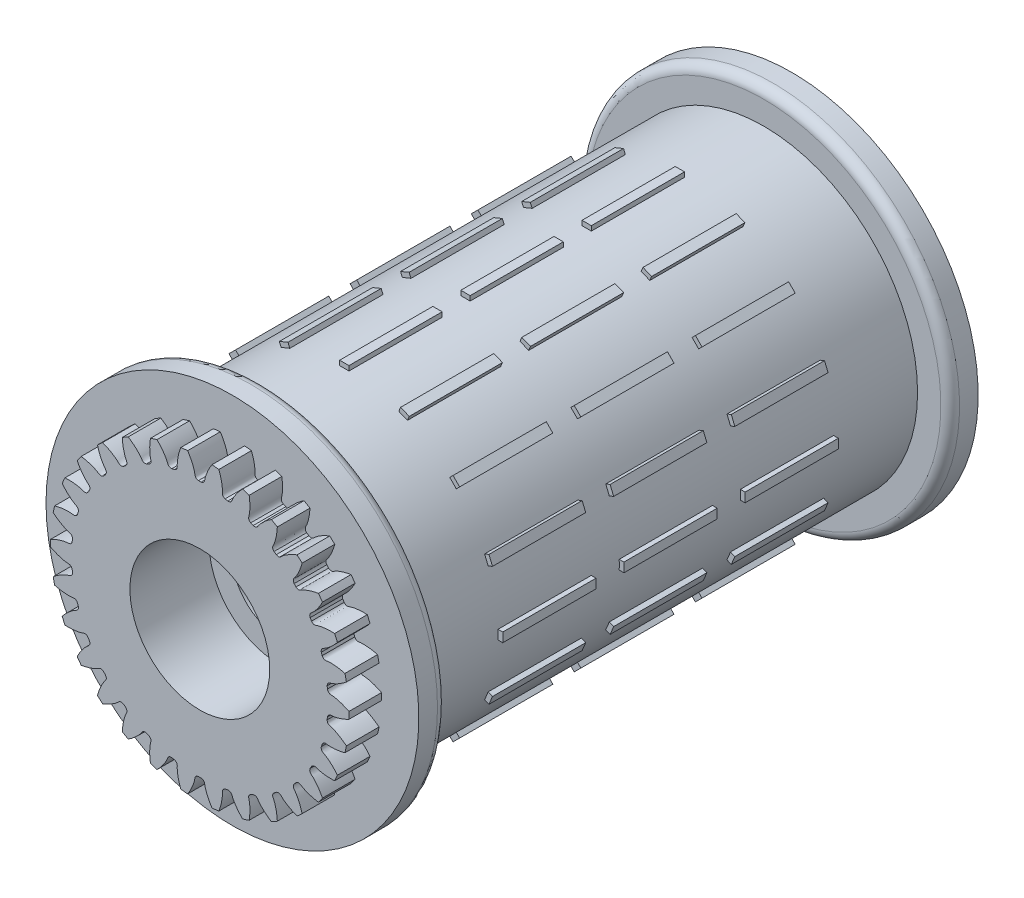
from build123d import *

# Parameters (mm, degrees)
FILLET_2_R                        = 1
EXTRUDE_START                     = 3.5
SKETCH_2_R                        = 7.5
EXTRUDE_1_DEPTH                   = 3.5
EXTRUDE_START_2                   = 15
SKETCH_4_W                        = 1
SKETCH_4_H                        = 10
EXTRUDE_2_DEPTH                   = 2
PATTERN_CIRCULAR_1_COUNT          = 16
PATTERN_LINEAR_1_COUNT            = 2
PATTERN_LINEAR_1_PITCH            = 13
PATTERN_START                     = 15
PATTERN_LINEAR_1_COPY_1_SKETCH_W  = 1
PATTERN_LINEAR_1_COPY_1_SKETCH_H  = 10
PATTERN_LINEAR_1_COPY_1_DEPTH     = 2
PATTERN_LINEAR_1_COPY_2_SKETCH_W  = 1
PATTERN_LINEAR_1_COPY_2_SKETCH_H  = 10
PATTERN_LINEAR_1_COPY_2_DEPTH     = 2
PATTERN_LINEAR_1_COPY_3_SKETCH_W  = 1
PATTERN_LINEAR_1_COPY_3_SKETCH_H  = 10
PATTERN_LINEAR_1_COPY_3_DEPTH     = 2
PATTERN_LINEAR_1_COPY_4_SKETCH_W  = 1
PATTERN_LINEAR_1_COPY_4_SKETCH_H  = 10
PATTERN_LINEAR_1_COPY_4_DEPTH     = 2
PATTERN_LINEAR_1_COPY_5_SKETCH_W  = 1
PATTERN_LINEAR_1_COPY_5_SKETCH_H  = 10
PATTERN_LINEAR_1_COPY_5_DEPTH     = 2
PATTERN_LINEAR_1_COPY_6_SKETCH_W  = 1
PATTERN_LINEAR_1_COPY_6_SKETCH_H  = 10
PATTERN_LINEAR_1_COPY_6_DEPTH     = 2
PATTERN_LINEAR_1_COPY_7_SKETCH_W  = 1
PATTERN_LINEAR_1_COPY_7_SKETCH_H  = 10
PATTERN_LINEAR_1_COPY_7_DEPTH     = 2
PATTERN_LINEAR_1_COPY_8_SKETCH_W  = 1
PATTERN_LINEAR_1_COPY_8_SKETCH_H  = 10
PATTERN_LINEAR_1_COPY_8_DEPTH     = 2
PATTERN_LINEAR_1_COPY_9_SKETCH_W  = 1
PATTERN_LINEAR_1_COPY_9_SKETCH_H  = 10
PATTERN_LINEAR_1_COPY_9_DEPTH     = 2
PATTERN_LINEAR_1_COPY_10_SKETCH_W = 1
PATTERN_LINEAR_1_COPY_10_SKETCH_H = 10
PATTERN_LINEAR_1_COPY_10_DEPTH    = 2
PATTERN_LINEAR_1_COPY_11_SKETCH_W = 1
PATTERN_LINEAR_1_COPY_11_SKETCH_H = 10
PATTERN_LINEAR_1_COPY_11_DEPTH    = 2
PATTERN_LINEAR_1_COPY_12_SKETCH_W = 1
PATTERN_LINEAR_1_COPY_12_SKETCH_H = 10
PATTERN_LINEAR_1_COPY_12_DEPTH    = 2
PATTERN_LINEAR_1_COPY_13_SKETCH_W = 1
PATTERN_LINEAR_1_COPY_13_SKETCH_H = 10
PATTERN_LINEAR_1_COPY_13_DEPTH    = 2
PATTERN_LINEAR_1_COPY_14_SKETCH_W = 1
PATTERN_LINEAR_1_COPY_14_SKETCH_H = 10
PATTERN_LINEAR_1_COPY_14_DEPTH    = 2
PATTERN_LINEAR_1_COPY_15_SKETCH_W = 1
PATTERN_LINEAR_1_COPY_15_SKETCH_H = 10
PATTERN_LINEAR_1_COPY_15_DEPTH    = 2
PATTERN_LINEAR_2_COUNT            = 2
PATTERN_LINEAR_2_PITCH            = 13
PATTERN_LINEAR_2_COPY_1_SKETCH_W  = 1
PATTERN_LINEAR_2_COPY_1_SKETCH_H  = 10
PATTERN_LINEAR_2_COPY_1_DEPTH     = 2
PATTERN_LINEAR_2_COPY_2_SKETCH_W  = 1
PATTERN_LINEAR_2_COPY_2_SKETCH_H  = 10
PATTERN_LINEAR_2_COPY_2_DEPTH     = 2
PATTERN_LINEAR_2_COPY_3_SKETCH_W  = 1
PATTERN_LINEAR_2_COPY_3_SKETCH_H  = 10
PATTERN_LINEAR_2_COPY_3_DEPTH     = 2
PATTERN_LINEAR_2_COPY_4_SKETCH_W  = 1
PATTERN_LINEAR_2_COPY_4_SKETCH_H  = 10
PATTERN_LINEAR_2_COPY_4_DEPTH     = 2
PATTERN_LINEAR_2_COPY_5_SKETCH_W  = 1
PATTERN_LINEAR_2_COPY_5_SKETCH_H  = 10
PATTERN_LINEAR_2_COPY_5_DEPTH     = 2
PATTERN_LINEAR_2_COPY_6_SKETCH_W  = 1
PATTERN_LINEAR_2_COPY_6_SKETCH_H  = 10
PATTERN_LINEAR_2_COPY_6_DEPTH     = 2
PATTERN_LINEAR_2_COPY_7_SKETCH_W  = 1
PATTERN_LINEAR_2_COPY_7_SKETCH_H  = 10
PATTERN_LINEAR_2_COPY_7_DEPTH     = 2
PATTERN_LINEAR_2_COPY_8_SKETCH_W  = 1
PATTERN_LINEAR_2_COPY_8_SKETCH_H  = 10
PATTERN_LINEAR_2_COPY_8_DEPTH     = 2
PATTERN_LINEAR_2_COPY_9_SKETCH_W  = 1
PATTERN_LINEAR_2_COPY_9_SKETCH_H  = 10
PATTERN_LINEAR_2_COPY_9_DEPTH     = 2
PATTERN_LINEAR_2_COPY_10_SKETCH_W = 1
PATTERN_LINEAR_2_COPY_10_SKETCH_H = 10
PATTERN_LINEAR_2_COPY_10_DEPTH    = 2
PATTERN_LINEAR_2_COPY_11_SKETCH_W = 1
PATTERN_LINEAR_2_COPY_11_SKETCH_H = 10
PATTERN_LINEAR_2_COPY_11_DEPTH    = 2
PATTERN_LINEAR_2_COPY_12_SKETCH_W = 1
PATTERN_LINEAR_2_COPY_12_SKETCH_H = 10
PATTERN_LINEAR_2_COPY_12_DEPTH    = 2
PATTERN_LINEAR_2_COPY_13_SKETCH_W = 1
PATTERN_LINEAR_2_COPY_13_SKETCH_H = 10
PATTERN_LINEAR_2_COPY_13_DEPTH    = 2
PATTERN_LINEAR_2_COPY_14_SKETCH_W = 1
PATTERN_LINEAR_2_COPY_14_SKETCH_H = 10
PATTERN_LINEAR_2_COPY_14_DEPTH    = 2
PATTERN_LINEAR_2_COPY_15_SKETCH_W = 1
PATTERN_LINEAR_2_COPY_15_SKETCH_H = 10
PATTERN_LINEAR_2_COPY_15_DEPTH    = 2


with BuildPart() as part:
    # 草图1 → 旋转1 (revolve)
    with BuildSketch(Plane(origin=(0, 0, 0), x_dir=(1, 0, 0), z_dir=(0, 1, 0)), mode=Mode.PRIVATE) as revolve_1_sk:
        Polygon((7.5, -55), (7.5, -60), (20, -60), (20, -57), (16.5, -57), (16.5, -3), (20, -3), (20, 0), (7.5, 0), (7.5, -5), (5, -5), (5, -55), align=None)
    revolve(revolve_1_sk.sketch.rotate(Axis((0, 0, 0), (0, 0, 1)), 180), axis=Axis((0, 0, 0), (0, 0, 1)))

    # 圆角2
    fillet_2_edges = [part.edges().sort_by_distance(p)[0] for p in [
        (20, 0, 3),
        (20, 0, 57),
    ]]
    fillet(fillet_2_edges, radius=FILLET_2_R)

    # 草图2 → 凸台-拉伸1 (add)
    with BuildSketch(Plane.XY.offset(60).offset(EXTRUDE_START)):
        with BuildLine():
            ThreePointArc((-2.716247736, 13.479039218), (-2.858785749, 13.44952951), (-3.001003383, 13.418512537))
            add(Edge.make_bspline(
                [(-3.001003383, 13.418512537), (-3.369003652, 13.40546142), (-3.419716461, 13.634070762), (-3.517532283, 13.860119802), (-3.538560643, 13.90630729), (-3.572718419, 13.977474487), (-3.624664976, 14.077588857), (-3.700110481, 14.209847265), (-3.792707643, 14.358131544), (-3.903840272, 14.521250385), (-4.034822464, 14.697928897), (-4.186895027, 14.886811473), (-4.361220932, 15.086465874), (-4.500096257, 15.233252262), (-4.580099062, 15.314041403), (-4.592702353, 15.326678867)],
                knots=[0.5485007, 0.5485007, 0.5485007, 0.5485007, 0.663824583, 0.67191327, 0.681013003, 0.691123781, 0.714378474, 0.741677349, 0.773020406, 0.808407645, 0.847839066, 0.891314668, 0.938834453, 0.990398419, 1, 1, 1, 1], degree=3))
            ThreePointArc((-4.592702353, 15.326678867), (-4.94427191, 15.216904261), (-5.293221551, 15.099066382))
            add(Edge.make_bspline(
                [(-5.293221551, 15.099066382), (-5.310855745, 14.986744462), (-5.337705864, 14.786448591), (-5.362979142, 14.504678569), (-5.374986111, 14.262483316), (-5.377103952, 14.042557981), (-5.371986269, 13.873454013), (-5.362807745, 13.723373087), (-5.353006616, 13.614785961), (-5.338258878, 13.493510224), (-5.325363451, 13.408005596), (-5.311166643, 13.330352687), (-5.30103062, 13.280626065), (-5.24729699, 13.040253852), (-5.153951314, 12.825496768), (-5.45934104, 12.619750212)],
                knots=[0, 0, 0, 0, 0.061165547, 0.108685332, 0.152160934, 0.191592355, 0.226979594, 0.243156645, 0.272477611, 0.285621526, 0.308876219, 0.318986997, 0.32808673, 0.336175417, 0.4514993, 0.4514993, 0.4514993, 0.4514993], degree=3))
            ThreePointArc((-5.45934104, 12.619750212), (-5.592628842, 12.561250043), (-5.725289888, 12.501342156))
            add(Edge.make_bspline(
                [(-5.725289888, 12.501342156), (-6.082534989, 12.412064679), (-6.179670156, 12.625134573), (-6.322346706, 12.825906846), (-6.352518465, 12.866712985), (-6.400726304, 12.929223207), (-6.472352651, 13.01634954), (-6.57364756, 13.130031783), (-6.695051288, 13.255823662), (-6.837669716, 13.392272193), (-7.002523161, 13.537857126), (-7.19054347, 13.6909945), (-7.402570419, 13.85004158), (-7.568929591, 13.96474653), (-7.66398115, 14.027136716), (-7.678936505, 14.036877649)],
                knots=[0.5485007, 0.5485007, 0.5485007, 0.5485007, 0.663824583, 0.67191327, 0.681013003, 0.691123781, 0.714378474, 0.741677349, 0.773020406, 0.808407645, 0.847839066, 0.891314668, 0.938834453, 0.990398419, 1, 1, 1, 1], degree=3))
            ThreePointArc((-7.678936505, 14.036877649), (-8, 13.856406461), (-8.316824382, 13.668592912))
            add(Edge.make_bspline(
                [(-8.316824382, 13.668592912), (-8.310720186, 13.555059141), (-8.295339712, 13.353557761), (-8.261477427, 13.072690481), (-8.22286679, 12.833291385), (-8.179213303, 12.617731623), (-8.139048762, 12.453387009), (-8.098867232, 12.308494033), (-8.066703747, 12.204317566), (-8.027063639, 12.088758222), (-7.996672596, 12.007803185), (-7.966641076, 11.934798861), (-7.946387802, 11.888266282), (-7.843852188, 11.664318629), (-7.70789583, 11.47366216), (-7.963834944, 11.208917565)],
                knots=[0, 0, 0, 0, 0.061165547, 0.108685332, 0.152160934, 0.191592355, 0.226979594, 0.243156645, 0.272477611, 0.285621526, 0.308876219, 0.318986997, 0.32808673, 0.336175417, 0.4514993, 0.4514993, 0.4514993, 0.4514993], degree=3))
            ThreePointArc((-7.963834944, 11.208917565), (-8.082047219, 11.123983673), (-8.199353753, 11.037803134))
            add(Edge.make_bspline(
                [(-8.199353753, 11.037803134), (-8.53023036, 10.876201151), (-8.669542613, 11.064419421), (-8.85084424, 11.231140215), (-8.888840747, 11.264781581), (-8.948991735, 11.315902831), (-9.037167458, 11.38623329), (-9.159884697, 11.476370907), (-9.304789065, 11.574172677), (-9.472660183, 11.677987442), (-9.664179994, 11.786116037), (-9.879930658, 11.896815372), (-10.120392058, 12.00830401), (-10.306964383, 12.085914364), (-10.412910486, 12.127178845), (-10.429564285, 12.133597522)],
                knots=[0.5485007, 0.5485007, 0.5485007, 0.5485007, 0.663824583, 0.67191327, 0.681013003, 0.691123781, 0.714378474, 0.741677349, 0.773020406, 0.808407645, 0.847839066, 0.891314668, 0.938834453, 0.990398419, 1, 1, 1, 1], degree=3))
            ThreePointArc((-10.429564285, 12.133597522), (-10.706089702, 11.890317208), (-10.976942078, 11.640736343))
            add(Edge.make_bspline(
                [(-10.976942078, 11.640736343), (-10.947366276, 11.530952691), (-10.890427409, 11.33705238), (-10.798909505, 11.069363088), (-10.711368733, 10.84322304), (-10.623851784, 10.641449846), (-10.550395768, 10.489047234), (-10.480967357, 10.355674727), (-10.427847216, 10.26046193), (-10.365047201, 10.155669477), (-10.318488777, 10.082802155), (-10.273935065, 10.017637055), (-10.244449707, 9.976332217), (-10.097593407, 9.77859671), (-9.924968313, 9.620373458), (-10.120271046, 9.308201435)],
                knots=[0, 0, 0, 0, 0.061165547, 0.108685332, 0.152160934, 0.191592355, 0.226979594, 0.243156645, 0.272477611, 0.285621526, 0.308876219, 0.318986997, 0.32808673, 0.336175417, 0.4514993, 0.4514993, 0.4514993, 0.4514993], degree=3))
            ThreePointArc((-10.120271046, 9.308201435), (-10.21824135, 9.200545837), (-10.315066514, 9.091859151))
            add(Edge.make_bspline(
                [(-10.315066514, 9.091859151), (-10.605113732, 8.864995444), (-10.780514456, 9.020136046), (-10.99251741, 9.145518864), (-11.036678035, 9.170525167), (-11.106143285, 9.208023201), (-11.207014682, 9.258484008), (-11.34579092, 9.321137553), (-11.50786291, 9.386674807), (-11.693649945, 9.453318602), (-11.903465788, 9.51926512), (-12.137517468, 9.582688324), (-12.395904, 9.641745931), (-12.594535372, 9.678869746), (-12.706745667, 9.697205065), (-12.724370058, 9.70002096)],
                knots=[0.5485007, 0.5485007, 0.5485007, 0.5485007, 0.663824583, 0.67191327, 0.681013003, 0.691123781, 0.714378474, 0.741677349, 0.773020406, 0.808407645, 0.847839066, 0.891314668, 0.938834453, 0.990398419, 1, 1, 1, 1], degree=3))
            ThreePointArc((-12.724370058, 9.70002096), (-12.94427191, 9.404564037), (-13.157314733, 9.104123738))
            add(Edge.make_bspline(
                [(-13.157314733, 9.104123738), (-13.105559928, 9.002888276), (-13.00955117, 8.825063409), (-12.864377419, 8.582251412), (-12.731732463, 8.379253817), (-12.604176964, 8.200085648), (-12.500639853, 8.066285763), (-12.404998916, 7.950262744), (-12.333243724, 7.868174873), (-12.250028464, 7.778729244), (-12.189337485, 7.717134288), (-12.132208792, 7.66265644), (-12.094780001, 7.628384562), (-11.91002134, 7.465503192), (-11.708272054, 7.346628273), (-11.834402742, 7.000672236)],
                knots=[0, 0, 0, 0, 0.061165547, 0.108685332, 0.152160934, 0.191592355, 0.226979594, 0.243156645, 0.272477611, 0.285621526, 0.308876219, 0.318986997, 0.32808673, 0.336175417, 0.4514993, 0.4514993, 0.4514993, 0.4514993], degree=3))
            ThreePointArc((-11.834402742, 7.000672236), (-11.907849302, 6.875), (-11.97996137, 6.748557295))
            add(Edge.make_bspline(
                [(-11.97996137, 6.748557295), (-12.216502744, 6.466346897), (-12.420326086, 6.581629444), (-12.653764821, 6.660194453), (-12.702159533, 6.675472798), (-12.777903081, 6.697708773), (-12.887061587, 6.726094547), (-13.035831635, 6.758525759), (-13.207987925, 6.788934206), (-13.403571092, 6.815494378), (-13.622513007, 6.836376639), (-13.864636522, 6.849751813), (-14.129655456, 6.85379729), (-14.331664731, 6.848812075), (-14.445235088, 6.843416892), (-14.463059802, 6.842506935)],
                knots=[0.5485007, 0.5485007, 0.5485007, 0.5485007, 0.663824583, 0.67191327, 0.681013003, 0.691123781, 0.714378474, 0.741677349, 0.773020406, 0.808407645, 0.847839066, 0.891314668, 0.938834453, 0.990398419, 1, 1, 1, 1], degree=3))
            ThreePointArc((-14.463059802, 6.842506935), (-14.616727322, 6.507786289), (-14.762649597, 6.169617238))
            add(Edge.make_bspline(
                [(-14.762649597, 6.169617238), (-14.690977723, 6.081354443), (-14.560095119, 5.927376819), (-14.367610309, 5.720054168), (-14.19565839, 5.549070993), (-14.033639128, 5.400338358), (-13.904545991, 5.290988898), (-13.786872496, 5.197386129), (-13.699618299, 5.132010818), (-13.5996247, 5.061821216), (-13.527453653, 5.014190622), (-13.460246778, 4.972780968), (-13.416510372, 4.947039897), (-13.20192419, 4.826131361), (-12.979868125, 4.75180018), (-13.031314249, 4.387180067)],
                knots=[0, 0, 0, 0, 0.061165547, 0.108685332, 0.152160934, 0.191592355, 0.226979594, 0.243156645, 0.272477611, 0.285621526, 0.308876219, 0.318986997, 0.32808673, 0.336175417, 0.4514993, 0.4514993, 0.4514993, 0.4514993], degree=3))
            ThreePointArc((-13.031314249, 4.387180067), (-13.077027099, 4.248983673), (-13.121274429, 4.110311102))
            add(Edge.make_bspline(
                [(-13.121274429, 4.110311102), (-13.293971965, 3.785087961), (-13.517309868, 3.855474052), (-13.76198199, 3.883787585), (-13.812495708, 3.888670236), (-13.891207196, 3.894672332), (-14.003882062, 3.899742479), (-14.156143956, 3.90053396), (-14.330860489, 3.894484604), (-14.527691864, 3.879800345), (-14.74619104, 3.854705695), (-14.985804431, 3.81744828), (-15.245873166, 3.766304818), (-15.44243157, 3.719428453), (-15.552398421, 3.690538562), (-15.569644431, 3.685942524)],
                knots=[0.5485007, 0.5485007, 0.5485007, 0.5485007, 0.663824583, 0.67191327, 0.681013003, 0.691123781, 0.714378474, 0.741677349, 0.773020406, 0.808407645, 0.847839066, 0.891314668, 0.938834453, 0.990398419, 1, 1, 1, 1], degree=3))
            ThreePointArc((-15.569644431, 3.685942524), (-15.650361612, 3.326587053), (-15.722785836, 2.96546886))
            add(Edge.make_bspline(
                [(-15.722785836, 2.96546886), (-15.634329297, 2.89403624), (-15.474293043, 2.77063542), (-15.242909686, 2.607863108), (-15.039165928, 2.47636714), (-14.849763922, 2.364570369), (-14.700756748, 2.284450429), (-14.566193592, 2.2173588), (-14.467253817, 2.171553265), (-14.354852079, 2.123687312), (-14.274355185, 2.092102765), (-14.20000739, 2.065571107), (-14.15187486, 2.04948585), (-13.916839603, 1.975834432), (-13.684181674, 1.949295616), (-13.658694793, 1.581947077)],
                knots=[0, 0, 0, 0, 0.061165547, 0.108685332, 0.152160934, 0.191592355, 0.226979594, 0.243156645, 0.272477611, 0.285621526, 0.308876219, 0.318986997, 0.32808673, 0.336175417, 0.4514993, 0.4514993, 0.4514993, 0.4514993], degree=3))
            ThreePointArc((-13.658694793, 1.581947077), (-13.674676061, 1.43726637), (-13.689124832, 1.29242459))
            add(Edge.make_bspline(
                [(-13.689124832, 1.29242459), (-13.79043082, 0.938402519), (-14.023522345, 0.960815944), (-14.268734509, 0.937640564), (-14.319159541, 0.931914124), (-14.3973989, 0.921420021), (-14.508665692, 0.902952952), (-14.657764856, 0.872070109), (-14.827405683, 0.829827336), (-15.016882791, 0.77454042), (-15.225389765, 0.704565615), (-15.452020775, 0.618303938), (-15.695773062, 0.514206754), (-15.878290048, 0.427487959), (-15.979847313, 0.376365988), (-15.995760887, 0.368284737)],
                knots=[0.5485007, 0.5485007, 0.5485007, 0.5485007, 0.663824583, 0.67191327, 0.681013003, 0.691123781, 0.714378474, 0.741677349, 0.773020406, 0.808407645, 0.847839066, 0.891314668, 0.938834453, 0.990398419, 1, 1, 1, 1], degree=3))
            ThreePointArc((-15.995760887, 0.368284737), (-16, 0), (-15.995760887, -0.368284737))
            add(Edge.make_bspline(
                [(-15.995760887, -0.368284737), (-15.894385659, -0.419765235), (-15.712190108, -0.507196043), (-15.452020766, -0.618304084), (-15.225389749, -0.70456584), (-15.016882775, -0.774540692), (-14.854473894, -0.821929486), (-14.708902131, -0.859577748), (-14.602600921, -0.883811587), (-14.48270354, -0.907261918), (-14.3973989, -0.921420021), (-14.319159541, -0.931914124), (-14.268734509, -0.937640564), (-14.023522345, -0.960815944), (-13.79043082, -0.938402519), (-13.689124832, -1.29242459)],
                knots=[0, 0, 0, 0, 0.061165547, 0.108685332, 0.152160934, 0.191592355, 0.226979594, 0.243156645, 0.272477611, 0.285621526, 0.308876219, 0.318986997, 0.32808673, 0.336175417, 0.4514993, 0.4514993, 0.4514993, 0.4514993], degree=3))
            ThreePointArc((-13.689124832, -1.29242459), (-13.674676061, -1.43726637), (-13.658694793, -1.581947077))
            add(Edge.make_bspline(
                [(-13.658694793, -1.581947077), (-13.684181674, -1.949295616), (-13.916839603, -1.975834432), (-14.15187486, -2.04948585), (-14.20000739, -2.065571107), (-14.274355185, -2.092102765), (-14.379351012, -2.133299952), (-14.518771097, -2.19450739), (-14.675922098, -2.271097368), (-14.849763881, -2.364570639), (-15.039165897, -2.476367364), (-15.242909665, -2.607863252), (-15.459692357, -2.760364613), (-15.620191058, -2.883135809), (-15.708900199, -2.954255586), (-15.722785836, -2.96546886)],
                knots=[0.5485007, 0.5485007, 0.5485007, 0.5485007, 0.663824583, 0.67191327, 0.681013003, 0.691123781, 0.714378474, 0.741677349, 0.773020406, 0.808407645, 0.847839066, 0.891314668, 0.938834453, 0.990398419, 1, 1, 1, 1], degree=3))
            ThreePointArc((-15.722785836, -2.96546886), (-15.650361612, -3.326587053), (-15.569644431, -3.685942524))
            add(Edge.make_bspline(
                [(-15.569644431, -3.685942524), (-15.459781098, -3.715220954), (-15.26338907, -3.762860604), (-14.985804391, -3.81744842), (-14.746190978, -3.854705912), (-14.527691792, -3.879800608), (-14.35897925, -3.892387138), (-14.208761066, -3.898946624), (-14.099744294, -3.900549631), (-13.97759136, -3.898559449), (-13.891207196, -3.894672332), (-13.812495708, -3.888670235), (-13.76198199, -3.883787585), (-13.517309868, -3.855474052), (-13.293971965, -3.785087961), (-13.121274429, -4.110311102)],
                knots=[0, 0, 0, 0, 0.061165547, 0.108685332, 0.152160934, 0.191592355, 0.226979594, 0.243156645, 0.272477611, 0.285621526, 0.308876219, 0.318986997, 0.32808673, 0.336175417, 0.4514993, 0.4514993, 0.4514993, 0.4514993], degree=3))
            ThreePointArc((-13.121274429, -4.110311102), (-13.077027099, -4.248983673), (-13.031314249, -4.387180067))
            add(Edge.make_bspline(
                [(-13.031314249, -4.387180067), (-12.979868125, -4.751800179), (-13.20192419, -4.826131361), (-13.416510372, -4.947039897), (-13.460246778, -4.972780968), (-13.527453653, -5.014190622), (-13.621589692, -5.076317411), (-13.745237372, -5.165174386), (-13.883030295, -5.27276422), (-14.033639032, -5.400338614), (-14.195658313, -5.549071205), (-14.367610259, -5.720054304), (-14.547948914, -5.914294801), (-14.679414766, -6.067752708), (-14.751398766, -6.155762014), (-14.762649597, -6.169617238)],
                knots=[0.5485007, 0.5485007, 0.5485007, 0.5485007, 0.663824583, 0.67191327, 0.681013003, 0.691123781, 0.714378474, 0.741677349, 0.773020406, 0.808407645, 0.847839066, 0.891314668, 0.938834453, 0.990398419, 1, 1, 1, 1], degree=3))
            ThreePointArc((-14.762649597, -6.169617238), (-14.616727322, -6.507786289), (-14.463059802, -6.842506935))
            add(Edge.make_bspline(
                [(-14.463059802, -6.842506935), (-14.349509918, -6.84830369), (-14.147504687, -6.854070101), (-13.864636454, -6.849751942), (-13.622512901, -6.836376839), (-13.403570966, -6.81549462), (-13.235928311, -6.792728795), (-13.087628961, -6.767912823), (-12.980661184, -6.746814939), (-12.861591366, -6.719471225), (-12.777903081, -6.697708773), (-12.702159533, -6.675472798), (-12.653764821, -6.660194453), (-12.420326086, -6.581629444), (-12.216502744, -6.466346897), (-11.97996137, -6.748557295)],
                knots=[0, 0, 0, 0, 0.061165547, 0.108685332, 0.152160934, 0.191592355, 0.226979594, 0.243156645, 0.272477611, 0.285621526, 0.308876219, 0.318986997, 0.32808673, 0.336175417, 0.4514993, 0.4514993, 0.4514993, 0.4514993], degree=3))
            ThreePointArc((-11.97996137, -6.748557295), (-11.907849302, -6.875), (-11.834402742, -7.000672236))
            add(Edge.make_bspline(
                [(-11.834402742, -7.000672236), (-11.708272054, -7.346628273), (-11.91002134, -7.465503192), (-12.094780001, -7.628384562), (-12.132208792, -7.66265644), (-12.189337485, -7.717134288), (-12.268499539, -7.797475441), (-12.370970817, -7.910098476), (-12.48338345, -8.043985973), (-12.604176817, -8.200085878), (-12.731732343, -8.379254008), (-12.864377341, -8.582251536), (-13.000390293, -8.809741927), (-13.097077608, -8.987179698), (-13.149190421, -9.088232104), (-13.157314733, -9.104123738)],
                knots=[0.5485007, 0.5485007, 0.5485007, 0.5485007, 0.663824583, 0.67191327, 0.681013003, 0.691123781, 0.714378474, 0.741677349, 0.773020406, 0.808407645, 0.847839066, 0.891314668, 0.938834453, 0.990398419, 1, 1, 1, 1], degree=3))
            ThreePointArc((-13.157314733, -9.104123738), (-12.94427191, -9.404564037), (-12.724370058, -9.70002096))
            add(Edge.make_bspline(
                [(-12.724370058, -9.70002096), (-12.612096299, -9.682082693), (-12.413306462, -9.645723845), (-12.137517375, -9.582688436), (-11.903465643, -9.519265293), (-11.693649772, -9.453318813), (-11.534403792, -9.396195608), (-11.394504669, -9.341088756), (-11.294260891, -9.29821206), (-11.183478112, -9.246709864), (-11.106143285, -9.208023201), (-11.036678035, -9.170525167), (-10.99251741, -9.145518864), (-10.780514456, -9.020136046), (-10.605113732, -8.864995444), (-10.315066514, -9.091859151)],
                knots=[0, 0, 0, 0, 0.061165547, 0.108685332, 0.152160934, 0.191592355, 0.226979594, 0.243156645, 0.272477611, 0.285621526, 0.308876219, 0.318986997, 0.32808673, 0.336175417, 0.4514993, 0.4514993, 0.4514993, 0.4514993], degree=3))
            ThreePointArc((-10.315066514, -9.091859151), (-10.21824135, -9.200545837), (-10.120271046, -9.308201435))
            add(Edge.make_bspline(
                [(-10.120271046, -9.308201435), (-9.924968313, -9.620373458), (-10.097593407, -9.77859671), (-10.244449707, -9.976332217), (-10.273935065, -10.017637055), (-10.318488777, -10.082802155), (-10.379217086, -10.177846377), (-10.456033475, -10.309313305), (-10.538152846, -10.46364694), (-10.623851593, -10.64145004), (-10.711368576, -10.843223202), (-10.798909403, -11.069363193), (-10.884652234, -11.320161056), (-10.942335313, -11.513823809), (-10.972299359, -11.623502841), (-10.976942078, -11.640736343)],
                knots=[0.5485007, 0.5485007, 0.5485007, 0.5485007, 0.663824583, 0.67191327, 0.681013003, 0.691123781, 0.714378474, 0.741677349, 0.773020406, 0.808407645, 0.847839066, 0.891314668, 0.938834453, 0.990398419, 1, 1, 1, 1], degree=3))
            ThreePointArc((-10.976942078, -11.640736343), (-10.706089702, -11.890317208), (-10.429564285, -12.133597522))
            add(Edge.make_bspline(
                [(-10.429564285, -12.133597522), (-10.323473552, -12.092708223), (-10.13658718, -12.015813171), (-9.879930544, -11.896815462), (-9.664179817, -11.786116175), (-9.47265997, -11.677987612), (-9.328770479, -11.589003585), (-9.203385846, -11.506014287), (-9.114247202, -11.443232696), (-9.016593201, -11.369822912), (-8.948991735, -11.315902831), (-8.888840747, -11.264781581), (-8.85084424, -11.231140215), (-8.669542613, -11.06441942), (-8.53023036, -10.876201151), (-8.199353753, -11.037803134)],
                knots=[0, 0, 0, 0, 0.061165547, 0.108685332, 0.152160934, 0.191592355, 0.226979594, 0.243156645, 0.272477611, 0.285621526, 0.308876219, 0.318986997, 0.32808673, 0.336175417, 0.4514993, 0.4514993, 0.4514993, 0.4514993], degree=3))
            ThreePointArc((-8.199353753, -11.037803134), (-8.082047219, -11.123983673), (-7.963834944, -11.208917565))
            add(Edge.make_bspline(
                [(-7.963834944, -11.208917565), (-7.70789583, -11.47366216), (-7.843852188, -11.664318629), (-7.946387802, -11.888266282), (-7.966641076, -11.934798861), (-7.996672596, -12.007803185), (-8.036313041, -12.113396588), (-8.084117296, -12.257961674), (-8.132354395, -12.425996326), (-8.179213075, -12.617731773), (-8.222866603, -12.833291511), (-8.261477306, -13.072690562), (-8.293202642, -13.335834827), (-8.309360456, -13.53725857), (-8.315866164, -13.650770728), (-8.316824382, -13.668592912)],
                knots=[0.5485007, 0.5485007, 0.5485007, 0.5485007, 0.663824583, 0.67191327, 0.681013003, 0.691123781, 0.714378474, 0.741677349, 0.773020406, 0.808407645, 0.847839066, 0.891314668, 0.938834453, 0.990398419, 1, 1, 1, 1], degree=3))
            ThreePointArc((-8.316824382, -13.668592912), (-8, -13.856406461), (-7.678936505, -14.036877649))
            add(Edge.make_bspline(
                [(-7.678936505, -14.036877649), (-7.583665473, -13.974824375), (-7.416850396, -13.860753804), (-7.190543339, -13.690994565), (-7.002522959, -13.537857225), (-6.837669472, -13.392272315), (-6.715425132, -13.275316495), (-6.610034899, -13.168071781), (-6.535897174, -13.088129153), (-6.455639901, -12.99602014), (-6.400726304, -12.929223207), (-6.352518465, -12.866712985), (-6.322346706, -12.825906846), (-6.179670156, -12.625134573), (-6.082534989, -12.412064679), (-5.725289888, -12.501342156)],
                knots=[0, 0, 0, 0, 0.061165547, 0.108685332, 0.152160934, 0.191592355, 0.226979594, 0.243156645, 0.272477611, 0.285621526, 0.308876219, 0.318986997, 0.32808673, 0.336175417, 0.4514993, 0.4514993, 0.4514993, 0.4514993], degree=3))
            ThreePointArc((-5.725289888, -12.501342156), (-5.592628842, -12.561250043), (-5.45934104, -12.619750212))
            add(Edge.make_bspline(
                [(-5.45934104, -12.619750212), (-5.153951314, -12.825496768), (-5.24729699, -13.040253852), (-5.30103062, -13.280626065), (-5.311166643, -13.330352687), (-5.325363451, -13.408005596), (-5.342183553, -13.519533242), (-5.3588864, -13.670878297), (-5.371133034, -13.845270045), (-5.377103698, -14.04255808), (-5.374985902, -14.2624834), (-5.362979007, -14.504678624), (-5.3393003, -14.768668623), (-5.313226676, -14.969050173), (-5.295989713, -15.08143443), (-5.293221551, -15.099066382)],
                knots=[0.5485007, 0.5485007, 0.5485007, 0.5485007, 0.663824583, 0.67191327, 0.681013003, 0.691123781, 0.714378474, 0.741677349, 0.773020406, 0.808407645, 0.847839066, 0.891314668, 0.938834453, 0.990398419, 1, 1, 1, 1], degree=3))
            ThreePointArc((-5.293221551, -15.099066382), (-4.94427191, -15.216904261), (-4.592702353, -15.326678867))
            add(Edge.make_bspline(
                [(-4.592702353, -15.326678867), (-4.512414822, -15.246173645), (-4.372961661, -15.099912984), (-4.186894886, -14.886811509), (-4.034822245, -14.697928952), (-3.903840008, -14.521250455), (-3.808583482, -14.381434372), (-3.727793709, -14.254621351), (-3.671897078, -14.161011561), (-3.612544159, -14.054228926), (-3.572718419, -13.977474487), (-3.538560643, -13.90630729), (-3.517532283, -13.860119802), (-3.419716461, -13.634070762), (-3.369003652, -13.40546142), (-3.001003383, -13.418512537)],
                knots=[0, 0, 0, 0, 0.061165547, 0.108685332, 0.152160934, 0.191592355, 0.226979594, 0.243156645, 0.272477611, 0.285621526, 0.308876219, 0.318986997, 0.32808673, 0.336175417, 0.4514993, 0.4514993, 0.4514993, 0.4514993], degree=3))
            ThreePointArc((-3.001003383, -13.418512537), (-2.858785749, -13.44952951), (-2.716247736, -13.479039218))
            add(Edge.make_bspline(
                [(-2.716247736, -13.479039218), (-2.374754393, -13.616795624), (-2.421409734, -13.846267408), (-2.423992962, -14.092558761), (-2.423568743, -14.143306135), (-2.421310368, -14.222213824), (-2.41457501, -14.334801419), (-2.399446453, -14.486311939), (-2.375167385, -14.659439027), (-2.339989088, -14.853657216), (-2.292192525, -15.068336326), (-2.230092791, -15.302742628), (-2.152044913, -15.556040733), (-2.084879394, -15.746622454), (-2.044653099, -15.852967079), (-2.038279539, -15.869638198)],
                knots=[0.5485007, 0.5485007, 0.5485007, 0.5485007, 0.663824583, 0.67191327, 0.681013003, 0.691123781, 0.714378474, 0.741677349, 0.773020406, 0.808407645, 0.847839066, 0.891314668, 0.938834453, 0.990398419, 1, 1, 1, 1], degree=3))
            ThreePointArc((-2.038279539, -15.869638198), (-1.672455412, -15.912350326), (-1.30574507, -15.946630673))
            add(Edge.make_bspline(
                [(-1.30574507, -15.946630673), (-1.243949991, -15.851191966), (-1.137953517, -15.67913351), (-1.000259035, -15.432003355), (-0.890780439, -15.215630655), (-0.799394002, -15.015580268), (-0.735288458, -14.859014558), (-0.682630045, -14.718175567), (-0.64741746, -14.614989813), (-0.611562902, -14.498200468), (-0.588565596, -14.414843061), (-0.569950741, -14.338129238), (-0.55898482, -14.288579015), (-0.510304747, -14.047132636), (-0.50823069, -13.81297517), (-0.145558629, -13.749229531)],
                knots=[0, 0, 0, 0, 0.061165547, 0.108685332, 0.152160934, 0.191592355, 0.226979594, 0.243156645, 0.272477611, 0.285621526, 0.308876219, 0.318986997, 0.32808673, 0.336175417, 0.4514993, 0.4514993, 0.4514993, 0.4514993], degree=3))
            ThreePointArc((-0.145558629, -13.749229531), (0, -13.75), (0.145558629, -13.749229531))
            add(Edge.make_bspline(
                [(0.145558629, -13.749229531), (0.50823069, -13.81297517), (0.510304747, -14.047132636), (0.55898482, -14.288579015), (0.569950741, -14.338129238), (0.588565596, -14.414843061), (0.618562048, -14.523569988), (0.664860818, -14.668624235), (0.724604475, -14.832920179), (0.799394275, -15.015580256), (0.890780664, -15.215630647), (1.000259181, -15.432003349), (1.129265163, -15.663539216), (1.234587123, -15.835991773), (1.296044667, -15.931648996), (1.30574507, -15.946630673)],
                knots=[0.5485007, 0.5485007, 0.5485007, 0.5485007, 0.663824583, 0.67191327, 0.681013003, 0.691123781, 0.714378474, 0.741677349, 0.773020406, 0.808407645, 0.847839066, 0.891314668, 0.938834453, 0.990398419, 1, 1, 1, 1], degree=3))
            ThreePointArc((1.30574507, -15.946630673), (1.672455412, -15.912350326), (2.038279539, -15.869638198))
            add(Edge.make_bspline(
                [(2.038279539, -15.869638198), (2.078881424, -15.763437136), (2.146788656, -15.573100664), (2.230092935, -15.302742603), (2.292192747, -15.068336286), (2.339989357, -14.853657172), (2.370142199, -14.687184505), (2.392367827, -14.538474885), (2.405357408, -14.430222879), (2.416146588, -14.30853108), (2.421310368, -14.222213824), (2.423568743, -14.143306135), (2.423992962, -14.092558761), (2.421409734, -13.846267408), (2.374754393, -13.616795624), (2.716247735, -13.479039218)],
                knots=[0, 0, 0, 0, 0.061165547, 0.108685332, 0.152160934, 0.191592355, 0.226979594, 0.243156645, 0.272477611, 0.285621526, 0.308876219, 0.318986997, 0.32808673, 0.336175417, 0.4514993, 0.4514993, 0.4514993, 0.4514993], degree=3))
            ThreePointArc((2.716247735, -13.479039218), (2.858785749, -13.44952951), (3.001003383, -13.418512537))
            add(Edge.make_bspline(
                [(3.001003383, -13.418512537), (3.369003652, -13.40546142), (3.419716461, -13.634070762), (3.517532283, -13.860119802), (3.538560643, -13.90630729), (3.572718419, -13.977474487), (3.624664976, -14.077588857), (3.700110481, -14.209847265), (3.792707643, -14.358131544), (3.903840272, -14.521250385), (4.034822464, -14.697928897), (4.186895027, -14.886811473), (4.361220932, -15.086465874), (4.500096257, -15.233252262), (4.580099062, -15.314041403), (4.592702353, -15.326678867)],
                knots=[0.5485007, 0.5485007, 0.5485007, 0.5485007, 0.663824583, 0.67191327, 0.681013003, 0.691123781, 0.714378474, 0.741677349, 0.773020406, 0.808407645, 0.847839066, 0.891314668, 0.938834453, 0.990398419, 1, 1, 1, 1], degree=3))
            ThreePointArc((4.592702353, -15.326678867), (4.94427191, -15.216904261), (5.293221551, -15.099066382))
            add(Edge.make_bspline(
                [(5.293221551, -15.099066382), (5.310855745, -14.986744462), (5.337705864, -14.786448591), (5.362979142, -14.504678569), (5.374986111, -14.262483316), (5.377103952, -14.042557981), (5.371986269, -13.873454013), (5.362807745, -13.723373087), (5.353006616, -13.614785961), (5.338258878, -13.493510224), (5.325363451, -13.408005596), (5.311166643, -13.330352687), (5.30103062, -13.280626065), (5.24729699, -13.040253852), (5.153951314, -12.825496768), (5.45934104, -12.619750212)],
                knots=[0, 0, 0, 0, 0.061165547, 0.108685332, 0.152160934, 0.191592355, 0.226979594, 0.243156645, 0.272477611, 0.285621526, 0.308876219, 0.318986997, 0.32808673, 0.336175417, 0.4514993, 0.4514993, 0.4514993, 0.4514993], degree=3))
            ThreePointArc((5.45934104, -12.619750212), (5.592628842, -12.561250043), (5.725289888, -12.501342156))
            add(Edge.make_bspline(
                [(5.725289888, -12.501342156), (6.082534989, -12.412064679), (6.179670156, -12.625134573), (6.322346706, -12.825906846), (6.352518465, -12.866712985), (6.400726304, -12.929223207), (6.472352651, -13.01634954), (6.57364756, -13.130031783), (6.695051288, -13.255823662), (6.837669716, -13.392272193), (7.002523161, -13.537857126), (7.19054347, -13.6909945), (7.402570419, -13.85004158), (7.568929591, -13.96474653), (7.66398115, -14.027136716), (7.678936505, -14.036877649)],
                knots=[0.5485007, 0.5485007, 0.5485007, 0.5485007, 0.663824583, 0.67191327, 0.681013003, 0.691123781, 0.714378474, 0.741677349, 0.773020406, 0.808407645, 0.847839066, 0.891314668, 0.938834453, 0.990398419, 1, 1, 1, 1], degree=3))
            ThreePointArc((7.678936505, -14.036877649), (8, -13.856406461), (8.316824382, -13.668592912))
            add(Edge.make_bspline(
                [(8.316824382, -13.668592912), (8.310720186, -13.555059141), (8.295339712, -13.353557761), (8.261477427, -13.072690481), (8.22286679, -12.833291385), (8.179213303, -12.617731623), (8.139048762, -12.453387009), (8.098867232, -12.308494033), (8.066703747, -12.204317566), (8.027063639, -12.088758222), (7.996672596, -12.007803185), (7.966641076, -11.934798861), (7.946387802, -11.888266282), (7.843852188, -11.664318629), (7.70789583, -11.47366216), (7.963834944, -11.208917565)],
                knots=[0, 0, 0, 0, 0.061165547, 0.108685332, 0.152160934, 0.191592355, 0.226979594, 0.243156645, 0.272477611, 0.285621526, 0.308876219, 0.318986997, 0.32808673, 0.336175417, 0.4514993, 0.4514993, 0.4514993, 0.4514993], degree=3))
            ThreePointArc((7.963834944, -11.208917565), (8.082047219, -11.123983673), (8.199353753, -11.037803134))
            add(Edge.make_bspline(
                [(8.199353753, -11.037803134), (8.53023036, -10.876201151), (8.669542613, -11.06441942), (8.85084424, -11.231140215), (8.888840747, -11.264781581), (8.948991735, -11.315902831), (9.037167458, -11.38623329), (9.159884697, -11.476370907), (9.304789065, -11.574172677), (9.472660183, -11.677987442), (9.664179994, -11.786116037), (9.879930658, -11.896815372), (10.120392058, -12.00830401), (10.306964383, -12.085914364), (10.412910486, -12.127178845), (10.429564285, -12.133597522)],
                knots=[0.5485007, 0.5485007, 0.5485007, 0.5485007, 0.663824583, 0.67191327, 0.681013003, 0.691123781, 0.714378474, 0.741677349, 0.773020406, 0.808407645, 0.847839066, 0.891314668, 0.938834453, 0.990398419, 1, 1, 1, 1], degree=3))
            ThreePointArc((10.429564285, -12.133597522), (10.706089702, -11.890317208), (10.976942078, -11.640736343))
            add(Edge.make_bspline(
                [(10.976942078, -11.640736343), (10.947366276, -11.530952691), (10.890427409, -11.33705238), (10.798909505, -11.069363088), (10.711368733, -10.84322304), (10.623851784, -10.641449846), (10.550395768, -10.489047234), (10.480967357, -10.355674727), (10.427847216, -10.26046193), (10.365047201, -10.155669477), (10.318488777, -10.082802155), (10.273935065, -10.017637055), (10.244449707, -9.976332217), (10.097593407, -9.77859671), (9.924968313, -9.620373458), (10.120271046, -9.308201435)],
                knots=[0, 0, 0, 0, 0.061165547, 0.108685332, 0.152160934, 0.191592355, 0.226979594, 0.243156645, 0.272477611, 0.285621526, 0.308876219, 0.318986997, 0.32808673, 0.336175417, 0.4514993, 0.4514993, 0.4514993, 0.4514993], degree=3))
            ThreePointArc((10.120271046, -9.308201435), (10.21824135, -9.200545837), (10.315066514, -9.091859151))
            add(Edge.make_bspline(
                [(10.315066514, -9.091859151), (10.605113732, -8.864995444), (10.780514456, -9.020136046), (10.99251741, -9.145518864), (11.036678035, -9.170525167), (11.106143285, -9.208023201), (11.207014682, -9.258484008), (11.345790919, -9.321137553), (11.50786291, -9.386674807), (11.693649945, -9.453318602), (11.903465788, -9.51926512), (12.137517468, -9.582688324), (12.395904, -9.641745931), (12.594535372, -9.678869746), (12.706745667, -9.697205065), (12.724370058, -9.70002096)],
                knots=[0.5485007, 0.5485007, 0.5485007, 0.5485007, 0.663824583, 0.67191327, 0.681013003, 0.691123781, 0.714378474, 0.741677349, 0.773020406, 0.808407645, 0.847839066, 0.891314668, 0.938834453, 0.990398419, 1, 1, 1, 1], degree=3))
            ThreePointArc((12.724370058, -9.70002096), (12.94427191, -9.404564037), (13.157314733, -9.104123738))
            add(Edge.make_bspline(
                [(13.157314733, -9.104123738), (13.105559928, -9.002888276), (13.00955117, -8.825063409), (12.864377419, -8.582251412), (12.731732463, -8.379253817), (12.604176964, -8.200085648), (12.500639853, -8.066285763), (12.404998916, -7.950262744), (12.333243724, -7.868174873), (12.250028464, -7.778729244), (12.189337485, -7.717134288), (12.132208792, -7.66265644), (12.094780001, -7.628384562), (11.91002134, -7.465503192), (11.708272054, -7.346628273), (11.834402742, -7.000672236)],
                knots=[0, 0, 0, 0, 0.061165547, 0.108685332, 0.152160934, 0.191592355, 0.226979594, 0.243156645, 0.272477611, 0.285621526, 0.308876219, 0.318986997, 0.32808673, 0.336175417, 0.4514993, 0.4514993, 0.4514993, 0.4514993], degree=3))
            ThreePointArc((11.834402742, -7.000672236), (11.907849302, -6.875), (11.97996137, -6.748557295))
            add(Edge.make_bspline(
                [(11.97996137, -6.748557295), (12.216502744, -6.466346897), (12.420326086, -6.581629444), (12.653764821, -6.660194453), (12.702159533, -6.675472798), (12.777903081, -6.697708773), (12.887061587, -6.726094547), (13.035831635, -6.758525759), (13.207987925, -6.788934206), (13.403571092, -6.815494378), (13.622513007, -6.836376639), (13.864636522, -6.849751813), (14.129655456, -6.85379729), (14.331664731, -6.848812075), (14.445235088, -6.843416892), (14.463059802, -6.842506935)],
                knots=[0.5485007, 0.5485007, 0.5485007, 0.5485007, 0.663824583, 0.67191327, 0.681013003, 0.691123781, 0.714378474, 0.741677349, 0.773020406, 0.808407645, 0.847839066, 0.891314668, 0.938834453, 0.990398419, 1, 1, 1, 1], degree=3))
            ThreePointArc((14.463059802, -6.842506935), (14.616727322, -6.507786289), (14.762649597, -6.169617238))
            add(Edge.make_bspline(
                [(14.762649597, -6.169617238), (14.690977723, -6.081354443), (14.560095119, -5.927376819), (14.367610309, -5.720054167), (14.19565839, -5.549070993), (14.033639128, -5.400338358), (13.904545991, -5.290988898), (13.786872496, -5.197386129), (13.699618299, -5.132010818), (13.5996247, -5.061821216), (13.527453653, -5.014190622), (13.460246778, -4.972780968), (13.416510372, -4.947039897), (13.20192419, -4.826131361), (12.979868125, -4.751800179), (13.031314249, -4.387180067)],
                knots=[0, 0, 0, 0, 0.061165547, 0.108685332, 0.152160934, 0.191592355, 0.226979594, 0.243156645, 0.272477611, 0.285621526, 0.308876219, 0.318986997, 0.32808673, 0.336175417, 0.4514993, 0.4514993, 0.4514993, 0.4514993], degree=3))
            ThreePointArc((13.031314249, -4.387180067), (13.077027099, -4.248983673), (13.121274429, -4.110311102))
            add(Edge.make_bspline(
                [(13.121274429, -4.110311102), (13.293971965, -3.785087961), (13.517309868, -3.855474052), (13.76198199, -3.883787585), (13.812495708, -3.888670235), (13.891207196, -3.894672332), (14.003882062, -3.899742479), (14.156143956, -3.90053396), (14.330860489, -3.894484604), (14.527691864, -3.879800345), (14.74619104, -3.854705695), (14.985804431, -3.81744828), (15.245873166, -3.766304818), (15.44243157, -3.719428453), (15.552398421, -3.690538562), (15.569644431, -3.685942524)],
                knots=[0.5485007, 0.5485007, 0.5485007, 0.5485007, 0.663824583, 0.67191327, 0.681013003, 0.691123781, 0.714378474, 0.741677349, 0.773020406, 0.808407645, 0.847839066, 0.891314668, 0.938834453, 0.990398419, 1, 1, 1, 1], degree=3))
            ThreePointArc((15.569644431, -3.685942524), (15.650361612, -3.326587053), (15.722785836, -2.96546886))
            add(Edge.make_bspline(
                [(15.722785836, -2.96546886), (15.634329297, -2.89403624), (15.474293043, -2.77063542), (15.242909686, -2.607863108), (15.039165928, -2.47636714), (14.849763922, -2.364570369), (14.700756748, -2.284450429), (14.566193592, -2.2173588), (14.467253817, -2.171553265), (14.354852079, -2.123687312), (14.274355185, -2.092102765), (14.20000739, -2.065571107), (14.15187486, -2.04948585), (13.916839603, -1.975834432), (13.684181674, -1.949295616), (13.658694793, -1.581947077)],
                knots=[0, 0, 0, 0, 0.061165547, 0.108685332, 0.152160934, 0.191592355, 0.226979594, 0.243156645, 0.272477611, 0.285621526, 0.308876219, 0.318986997, 0.32808673, 0.336175417, 0.4514993, 0.4514993, 0.4514993, 0.4514993], degree=3))
            ThreePointArc((13.658694793, -1.581947077), (13.674676061, -1.43726637), (13.689124832, -1.29242459))
            add(Edge.make_bspline(
                [(13.689124832, -1.29242459), (13.79043082, -0.938402519), (14.023522345, -0.960815944), (14.268734509, -0.937640564), (14.319159541, -0.931914124), (14.3973989, -0.921420021), (14.508665692, -0.902952952), (14.657764856, -0.872070109), (14.827405683, -0.829827336), (15.016882791, -0.77454042), (15.225389765, -0.704565615), (15.452020775, -0.618303938), (15.695773062, -0.514206754), (15.878290048, -0.427487959), (15.979847313, -0.376365988), (15.995760887, -0.368284737)],
                knots=[0.5485007, 0.5485007, 0.5485007, 0.5485007, 0.663824583, 0.67191327, 0.681013003, 0.691123781, 0.714378474, 0.741677349, 0.773020406, 0.808407645, 0.847839066, 0.891314668, 0.938834453, 0.990398419, 1, 1, 1, 1], degree=3))
            ThreePointArc((15.995760887, -0.368284737), (16, 0), (15.995760887, 0.368284737))
            add(Edge.make_bspline(
                [(15.995760887, 0.368284737), (15.894385659, 0.419765235), (15.712190108, 0.507196043), (15.452020766, 0.618304084), (15.225389749, 0.70456584), (15.016882775, 0.774540692), (14.854473894, 0.821929486), (14.708902131, 0.859577748), (14.602600921, 0.883811587), (14.48270354, 0.907261918), (14.3973989, 0.921420021), (14.319159541, 0.931914124), (14.268734509, 0.937640564), (14.023522345, 0.960815944), (13.79043082, 0.938402519), (13.689124832, 1.29242459)],
                knots=[0, 0, 0, 0, 0.061165547, 0.108685332, 0.152160934, 0.191592355, 0.226979594, 0.243156645, 0.272477611, 0.285621526, 0.308876219, 0.318986997, 0.32808673, 0.336175417, 0.4514993, 0.4514993, 0.4514993, 0.4514993], degree=3))
            ThreePointArc((13.689124832, 1.29242459), (13.674676061, 1.43726637), (13.658694793, 1.581947077))
            add(Edge.make_bspline(
                [(13.658694793, 1.581947077), (13.684181674, 1.949295616), (13.916839603, 1.975834432), (14.15187486, 2.04948585), (14.20000739, 2.065571107), (14.274355185, 2.092102765), (14.379351012, 2.133299952), (14.518771097, 2.19450739), (14.675922098, 2.271097368), (14.849763881, 2.364570639), (15.039165897, 2.476367364), (15.242909665, 2.607863252), (15.459692357, 2.760364613), (15.620191058, 2.883135809), (15.708900199, 2.954255586), (15.722785836, 2.96546886)],
                knots=[0.5485007, 0.5485007, 0.5485007, 0.5485007, 0.663824583, 0.67191327, 0.681013003, 0.691123781, 0.714378474, 0.741677349, 0.773020406, 0.808407645, 0.847839066, 0.891314668, 0.938834453, 0.990398419, 1, 1, 1, 1], degree=3))
            ThreePointArc((15.722785836, 2.96546886), (15.650361612, 3.326587053), (15.569644431, 3.685942524))
            add(Edge.make_bspline(
                [(15.569644431, 3.685942524), (15.459781098, 3.715220954), (15.26338907, 3.762860604), (14.985804391, 3.81744842), (14.746190978, 3.854705912), (14.527691792, 3.879800608), (14.35897925, 3.892387138), (14.208761066, 3.898946624), (14.099744294, 3.900549631), (13.97759136, 3.898559449), (13.891207196, 3.894672332), (13.812495708, 3.888670236), (13.76198199, 3.883787585), (13.517309868, 3.855474052), (13.293971965, 3.785087961), (13.121274429, 4.110311102)],
                knots=[0, 0, 0, 0, 0.061165547, 0.108685332, 0.152160934, 0.191592355, 0.226979594, 0.243156645, 0.272477611, 0.285621526, 0.308876219, 0.318986997, 0.32808673, 0.336175417, 0.4514993, 0.4514993, 0.4514993, 0.4514993], degree=3))
            ThreePointArc((13.121274429, 4.110311102), (13.077027099, 4.248983673), (13.031314249, 4.387180067))
            add(Edge.make_bspline(
                [(13.031314249, 4.387180067), (12.979868125, 4.75180018), (13.20192419, 4.826131361), (13.416510372, 4.947039897), (13.460246778, 4.972780968), (13.527453653, 5.014190622), (13.621589692, 5.076317411), (13.745237372, 5.165174386), (13.883030295, 5.27276422), (14.033639032, 5.400338614), (14.195658313, 5.549071205), (14.367610259, 5.720054304), (14.547948913, 5.914294801), (14.679414766, 6.067752708), (14.751398766, 6.155762014), (14.762649597, 6.169617238)],
                knots=[0.5485007, 0.5485007, 0.5485007, 0.5485007, 0.663824583, 0.67191327, 0.681013003, 0.691123781, 0.714378474, 0.741677349, 0.773020406, 0.808407645, 0.847839066, 0.891314668, 0.938834453, 0.990398419, 1, 1, 1, 1], degree=3))
            ThreePointArc((14.762649597, 6.169617238), (14.616727322, 6.507786289), (14.463059802, 6.842506935))
            add(Edge.make_bspline(
                [(14.463059802, 6.842506935), (14.349509918, 6.84830369), (14.147504687, 6.854070101), (13.864636454, 6.849751942), (13.622512901, 6.836376839), (13.403570966, 6.81549462), (13.235928311, 6.792728795), (13.087628961, 6.767912823), (12.980661184, 6.746814939), (12.861591366, 6.719471225), (12.777903081, 6.697708773), (12.702159533, 6.675472798), (12.653764821, 6.660194453), (12.420326086, 6.581629444), (12.216502744, 6.466346897), (11.97996137, 6.748557295)],
                knots=[0, 0, 0, 0, 0.061165547, 0.108685332, 0.152160934, 0.191592355, 0.226979594, 0.243156645, 0.272477611, 0.285621526, 0.308876219, 0.318986997, 0.32808673, 0.336175417, 0.4514993, 0.4514993, 0.4514993, 0.4514993], degree=3))
            ThreePointArc((11.97996137, 6.748557295), (11.907849302, 6.875), (11.834402742, 7.000672236))
            add(Edge.make_bspline(
                [(11.834402742, 7.000672236), (11.708272054, 7.346628273), (11.91002134, 7.465503192), (12.094780001, 7.628384562), (12.132208792, 7.66265644), (12.189337485, 7.717134288), (12.268499539, 7.797475441), (12.370970817, 7.910098476), (12.48338345, 8.043985973), (12.604176817, 8.200085878), (12.731732343, 8.379254008), (12.864377341, 8.582251536), (13.000390293, 8.809741927), (13.097077608, 8.987179698), (13.149190421, 9.088232104), (13.157314733, 9.104123738)],
                knots=[0.5485007, 0.5485007, 0.5485007, 0.5485007, 0.663824583, 0.67191327, 0.681013003, 0.691123781, 0.714378474, 0.741677349, 0.773020406, 0.808407645, 0.847839066, 0.891314668, 0.938834453, 0.990398419, 1, 1, 1, 1], degree=3))
            ThreePointArc((13.157314733, 9.104123738), (12.94427191, 9.404564037), (12.724370058, 9.70002096))
            add(Edge.make_bspline(
                [(12.724370058, 9.70002096), (12.612096299, 9.682082693), (12.413306462, 9.645723845), (12.137517375, 9.582688436), (11.903465643, 9.519265293), (11.693649772, 9.453318813), (11.534403792, 9.396195608), (11.394504669, 9.341088756), (11.294260891, 9.29821206), (11.183478112, 9.246709864), (11.106143285, 9.208023201), (11.036678035, 9.170525167), (10.99251741, 9.145518864), (10.780514456, 9.020136046), (10.605113732, 8.864995444), (10.315066514, 9.091859151)],
                knots=[0, 0, 0, 0, 0.061165547, 0.108685332, 0.152160934, 0.191592355, 0.226979594, 0.243156645, 0.272477611, 0.285621526, 0.308876219, 0.318986997, 0.32808673, 0.336175417, 0.4514993, 0.4514993, 0.4514993, 0.4514993], degree=3))
            ThreePointArc((10.315066514, 9.091859151), (10.21824135, 9.200545837), (10.120271046, 9.308201435))
            add(Edge.make_bspline(
                [(10.120271046, 9.308201435), (9.924968313, 9.620373458), (10.097593407, 9.77859671), (10.244449707, 9.976332217), (10.273935065, 10.017637055), (10.318488777, 10.082802155), (10.379217086, 10.177846377), (10.456033475, 10.309313305), (10.538152846, 10.46364694), (10.623851593, 10.64145004), (10.711368576, 10.843223202), (10.798909403, 11.069363193), (10.884652234, 11.320161056), (10.942335313, 11.513823809), (10.972299359, 11.623502841), (10.976942078, 11.640736343)],
                knots=[0.5485007, 0.5485007, 0.5485007, 0.5485007, 0.663824583, 0.67191327, 0.681013003, 0.691123781, 0.714378474, 0.741677349, 0.773020406, 0.808407645, 0.847839066, 0.891314668, 0.938834453, 0.990398419, 1, 1, 1, 1], degree=3))
            ThreePointArc((10.976942078, 11.640736343), (10.706089702, 11.890317208), (10.429564285, 12.133597522))
            add(Edge.make_bspline(
                [(10.429564285, 12.133597522), (10.323473552, 12.092708223), (10.13658718, 12.015813171), (9.879930544, 11.896815462), (9.664179817, 11.786116175), (9.47265997, 11.677987612), (9.328770479, 11.589003585), (9.203385846, 11.506014287), (9.114247202, 11.443232696), (9.016593201, 11.369822912), (8.948991735, 11.315902831), (8.888840747, 11.264781581), (8.85084424, 11.231140215), (8.669542613, 11.064419421), (8.53023036, 10.876201151), (8.199353753, 11.037803134)],
                knots=[0, 0, 0, 0, 0.061165547, 0.108685332, 0.152160934, 0.191592355, 0.226979594, 0.243156645, 0.272477611, 0.285621526, 0.308876219, 0.318986997, 0.32808673, 0.336175417, 0.4514993, 0.4514993, 0.4514993, 0.4514993], degree=3))
            ThreePointArc((8.199353753, 11.037803134), (8.082047219, 11.123983673), (7.963834944, 11.208917565))
            add(Edge.make_bspline(
                [(7.963834944, 11.208917565), (7.70789583, 11.47366216), (7.843852188, 11.664318629), (7.946387802, 11.888266282), (7.966641076, 11.934798861), (7.996672596, 12.007803185), (8.036313041, 12.113396588), (8.084117296, 12.257961674), (8.132354395, 12.425996326), (8.179213075, 12.617731773), (8.222866603, 12.833291511), (8.261477306, 13.072690562), (8.293202642, 13.335834827), (8.309360456, 13.53725857), (8.315866164, 13.650770728), (8.316824382, 13.668592912)],
                knots=[0.5485007, 0.5485007, 0.5485007, 0.5485007, 0.663824583, 0.67191327, 0.681013003, 0.691123781, 0.714378474, 0.741677349, 0.773020406, 0.808407645, 0.847839066, 0.891314668, 0.938834453, 0.990398419, 1, 1, 1, 1], degree=3))
            ThreePointArc((8.316824382, 13.668592912), (8, 13.856406461), (7.678936505, 14.036877649))
            add(Edge.make_bspline(
                [(7.678936505, 14.036877649), (7.583665473, 13.974824375), (7.416850396, 13.860753804), (7.190543339, 13.690994565), (7.002522959, 13.537857225), (6.837669472, 13.392272315), (6.715425132, 13.275316495), (6.610034899, 13.168071781), (6.535897174, 13.088129153), (6.455639901, 12.99602014), (6.400726304, 12.929223207), (6.352518465, 12.866712985), (6.322346706, 12.825906846), (6.179670156, 12.625134573), (6.082534989, 12.412064679), (5.725289888, 12.501342156)],
                knots=[0, 0, 0, 0, 0.061165547, 0.108685332, 0.152160934, 0.191592355, 0.226979594, 0.243156645, 0.272477611, 0.285621526, 0.308876219, 0.318986997, 0.32808673, 0.336175417, 0.4514993, 0.4514993, 0.4514993, 0.4514993], degree=3))
            ThreePointArc((5.725289888, 12.501342156), (5.592628842, 12.561250043), (5.45934104, 12.619750212))
            add(Edge.make_bspline(
                [(5.45934104, 12.619750212), (5.153951314, 12.825496768), (5.24729699, 13.040253852), (5.30103062, 13.280626065), (5.311166643, 13.330352687), (5.325363451, 13.408005596), (5.342183553, 13.519533242), (5.3588864, 13.670878297), (5.371133034, 13.845270045), (5.377103698, 14.04255808), (5.374985902, 14.2624834), (5.362979007, 14.504678624), (5.3393003, 14.768668623), (5.313226676, 14.969050173), (5.295989713, 15.08143443), (5.293221551, 15.099066382)],
                knots=[0.5485007, 0.5485007, 0.5485007, 0.5485007, 0.663824583, 0.67191327, 0.681013003, 0.691123781, 0.714378474, 0.741677349, 0.773020406, 0.808407645, 0.847839066, 0.891314668, 0.938834453, 0.990398419, 1, 1, 1, 1], degree=3))
            ThreePointArc((5.293221551, 15.099066382), (4.94427191, 15.216904261), (4.592702353, 15.326678867))
            add(Edge.make_bspline(
                [(4.592702353, 15.326678867), (4.512414822, 15.246173645), (4.372961661, 15.099912984), (4.186894886, 14.886811509), (4.034822245, 14.697928952), (3.903840008, 14.521250455), (3.808583482, 14.381434372), (3.727793709, 14.254621351), (3.671897078, 14.161011561), (3.612544159, 14.054228926), (3.572718419, 13.977474487), (3.538560643, 13.90630729), (3.517532283, 13.860119802), (3.419716461, 13.634070762), (3.369003652, 13.40546142), (3.001003383, 13.418512537)],
                knots=[0, 0, 0, 0, 0.061165547, 0.108685332, 0.152160934, 0.191592355, 0.226979594, 0.243156645, 0.272477611, 0.285621526, 0.308876219, 0.318986997, 0.32808673, 0.336175417, 0.4514993, 0.4514993, 0.4514993, 0.4514993], degree=3))
            ThreePointArc((3.001003383, 13.418512537), (2.858785749, 13.44952951), (2.716247735, 13.479039218))
            add(Edge.make_bspline(
                [(2.716247735, 13.479039218), (2.374754393, 13.616795624), (2.421409734, 13.846267408), (2.423992962, 14.092558761), (2.423568743, 14.143306135), (2.421310368, 14.222213824), (2.41457501, 14.334801419), (2.399446453, 14.486311939), (2.375167385, 14.659439027), (2.339989087, 14.853657216), (2.292192525, 15.068336326), (2.230092791, 15.302742628), (2.152044913, 15.556040733), (2.084879394, 15.746622454), (2.044653099, 15.852967079), (2.038279539, 15.869638198)],
                knots=[0.5485007, 0.5485007, 0.5485007, 0.5485007, 0.663824583, 0.67191327, 0.681013003, 0.691123781, 0.714378474, 0.741677349, 0.773020406, 0.808407645, 0.847839066, 0.891314668, 0.938834453, 0.990398419, 1, 1, 1, 1], degree=3))
            ThreePointArc((2.038279539, 15.869638198), (1.672455412, 15.912350326), (1.30574507, 15.946630673))
            add(Edge.make_bspline(
                [(1.30574507, 15.946630673), (1.243949991, 15.851191966), (1.137953517, 15.67913351), (1.000259035, 15.432003355), (0.890780439, 15.215630655), (0.799394002, 15.015580268), (0.735288458, 14.859014558), (0.682630045, 14.718175567), (0.64741746, 14.614989813), (0.611562902, 14.498200468), (0.588565596, 14.414843061), (0.569950741, 14.338129238), (0.55898482, 14.288579015), (0.510304747, 14.047132636), (0.50823069, 13.81297517), (0.145558629, 13.749229531)],
                knots=[0, 0, 0, 0, 0.061165547, 0.108685332, 0.152160934, 0.191592355, 0.226979594, 0.243156645, 0.272477611, 0.285621526, 0.308876219, 0.318986997, 0.32808673, 0.336175417, 0.4514993, 0.4514993, 0.4514993, 0.4514993], degree=3))
            ThreePointArc((0.145558629, 13.749229531), (0, 13.75), (-0.145558629, 13.749229531))
            add(Edge.make_bspline(
                [(-0.145558629, 13.749229531), (-0.50823069, 13.81297517), (-0.510304747, 14.047132636), (-0.55898482, 14.288579015), (-0.569950741, 14.338129238), (-0.588565596, 14.414843061), (-0.618562048, 14.523569988), (-0.664860818, 14.668624235), (-0.724604475, 14.832920179), (-0.799394275, 15.015580256), (-0.890780664, 15.215630647), (-1.000259181, 15.432003349), (-1.129265163, 15.663539216), (-1.234587123, 15.835991773), (-1.296044667, 15.931648996), (-1.30574507, 15.946630673)],
                knots=[0.5485007, 0.5485007, 0.5485007, 0.5485007, 0.663824583, 0.67191327, 0.681013003, 0.691123781, 0.714378474, 0.741677349, 0.773020406, 0.808407645, 0.847839066, 0.891314668, 0.938834453, 0.990398419, 1, 1, 1, 1], degree=3))
            ThreePointArc((-1.30574507, 15.946630673), (-1.672455412, 15.912350326), (-2.038279539, 15.869638198))
            add(Edge.make_bspline(
                [(-2.038279539, 15.869638198), (-2.078881424, 15.763437136), (-2.146788656, 15.573100664), (-2.230092935, 15.302742603), (-2.292192747, 15.068336286), (-2.339989357, 14.853657172), (-2.370142199, 14.687184505), (-2.392367827, 14.538474885), (-2.405357408, 14.430222879), (-2.416146588, 14.30853108), (-2.421310368, 14.222213824), (-2.423568743, 14.143306135), (-2.423992962, 14.092558761), (-2.421409734, 13.846267408), (-2.374754393, 13.616795624), (-2.716247736, 13.479039218)],
                knots=[0, 0, 0, 0, 0.061165547, 0.108685332, 0.152160934, 0.191592355, 0.226979594, 0.243156645, 0.272477611, 0.285621526, 0.308876219, 0.318986997, 0.32808673, 0.336175417, 0.4514993, 0.4514993, 0.4514993, 0.4514993], degree=3))
        make_face()
        with Locations(Location((0, 0, 0), (0, 0, 180))):
            Circle(SKETCH_2_R, mode=Mode.SUBTRACT)
    extrude(amount=-EXTRUDE_1_DEPTH)

    # 草图4 → 凸台-拉伸2 (add)
    with BuildSketch(Plane(origin=(0, 0, 0), x_dir=(1, 0, 0), z_dir=(0, 1, 0)).offset(EXTRUDE_START_2)):
        with Locations((0, -30)):
            Rectangle(SKETCH_4_W, SKETCH_4_H)
    extrude_2 = extrude(amount=EXTRUDE_2_DEPTH)

    # 阵列(圆周)1: 凸台-拉伸2 ×16 about axis
    pattern_circular_1_axis = Axis((0, 0, 0), (0, 0, 1))
    for i in range(1, PATTERN_CIRCULAR_1_COUNT):
        add(extrude_2.rotate(pattern_circular_1_axis, i * 360 / PATTERN_CIRCULAR_1_COUNT))

    # 阵列(线性)1: 凸台-拉伸2 ×2
    with Locations(*[(0, 0, i * PATTERN_LINEAR_1_PITCH) for i in range(1, PATTERN_LINEAR_1_COUNT)]):
        add(extrude_2)

    # 阵列(线性)1 copy 1 sketch → 阵列(线性)1 copy 1 (add)
    with BuildSketch(Plane(origin=(0, 0, 13), x_dir=(0.9238795325112867, 0.3826834323650898, 0), z_dir=(-0.3826834323650898, 0.9238795325112867, 0)).offset(PATTERN_START)):
        with Locations((0, -30)):
            Rectangle(PATTERN_LINEAR_1_COPY_1_SKETCH_W, PATTERN_LINEAR_1_COPY_1_SKETCH_H)
    extrude(amount=PATTERN_LINEAR_1_COPY_1_DEPTH)

    # 阵列(线性)1 copy 2 sketch → 阵列(线性)1 copy 2 (add)
    with BuildSketch(Plane(origin=(0, 0, 13), x_dir=(0.7071067811865476, 0.7071067811865475, 0), z_dir=(-0.7071067811865475, 0.7071067811865476, 0)).offset(PATTERN_START)):
        with Locations((0, -30)):
            Rectangle(PATTERN_LINEAR_1_COPY_2_SKETCH_W, PATTERN_LINEAR_1_COPY_2_SKETCH_H)
    extrude(amount=PATTERN_LINEAR_1_COPY_2_DEPTH)

    # 阵列(线性)1 copy 3 sketch → 阵列(线性)1 copy 3 (add)
    with BuildSketch(Plane(origin=(0, 0, 13), x_dir=(0.38268343236508984, 0.9238795325112867, 0), z_dir=(-0.9238795325112867, 0.38268343236508984, 0)).offset(PATTERN_START)):
        with Locations((0, -30)):
            Rectangle(PATTERN_LINEAR_1_COPY_3_SKETCH_W, PATTERN_LINEAR_1_COPY_3_SKETCH_H)
    extrude(amount=PATTERN_LINEAR_1_COPY_3_DEPTH)

    # 阵列(线性)1 copy 4 sketch → 阵列(线性)1 copy 4 (add)
    with BuildSketch(Plane(origin=(0, 0, 13), x_dir=(0, 1, 0), z_dir=(-1, 0, 0)).offset(PATTERN_START)):
        with Locations((0, -30)):
            Rectangle(PATTERN_LINEAR_1_COPY_4_SKETCH_W, PATTERN_LINEAR_1_COPY_4_SKETCH_H)
    extrude(amount=PATTERN_LINEAR_1_COPY_4_DEPTH)

    # 阵列(线性)1 copy 5 sketch → 阵列(线性)1 copy 5 (add)
    with BuildSketch(Plane(origin=(0, 0, 13), x_dir=(-0.3826834323650897, 0.9238795325112867, 0), z_dir=(-0.9238795325112867, -0.3826834323650897, 0)).offset(PATTERN_START)):
        with Locations((0, -30)):
            Rectangle(PATTERN_LINEAR_1_COPY_5_SKETCH_W, PATTERN_LINEAR_1_COPY_5_SKETCH_H)
    extrude(amount=PATTERN_LINEAR_1_COPY_5_DEPTH)

    # 阵列(线性)1 copy 6 sketch → 阵列(线性)1 copy 6 (add)
    with BuildSketch(Plane(origin=(0, 0, 13), x_dir=(-0.7071067811865475, 0.7071067811865476, 0), z_dir=(-0.7071067811865476, -0.7071067811865475, 0)).offset(PATTERN_START)):
        with Locations((0, -30)):
            Rectangle(PATTERN_LINEAR_1_COPY_6_SKETCH_W, PATTERN_LINEAR_1_COPY_6_SKETCH_H)
    extrude(amount=PATTERN_LINEAR_1_COPY_6_DEPTH)

    # 阵列(线性)1 copy 7 sketch → 阵列(线性)1 copy 7 (add)
    with BuildSketch(Plane(origin=(0, 0, 13), x_dir=(-0.9238795325112867, 0.3826834323650899, 0), z_dir=(-0.3826834323650899, -0.9238795325112867, 0)).offset(PATTERN_START)):
        with Locations((0, -30)):
            Rectangle(PATTERN_LINEAR_1_COPY_7_SKETCH_W, PATTERN_LINEAR_1_COPY_7_SKETCH_H)
    extrude(amount=PATTERN_LINEAR_1_COPY_7_DEPTH)

    # 阵列(线性)1 copy 8 sketch → 阵列(线性)1 copy 8 (add)
    with BuildSketch(Plane(origin=(0, 0, 13), x_dir=(-1, 0, 0), z_dir=(0, -1, 0)).offset(PATTERN_START)):
        with Locations((0, -30)):
            Rectangle(PATTERN_LINEAR_1_COPY_8_SKETCH_W, PATTERN_LINEAR_1_COPY_8_SKETCH_H)
    extrude(amount=PATTERN_LINEAR_1_COPY_8_DEPTH)

    # 阵列(线性)1 copy 9 sketch → 阵列(线性)1 copy 9 (add)
    with BuildSketch(Plane(origin=(0, 0, 13), x_dir=(-0.9238795325112868, -0.38268343236508967, 0), z_dir=(0.38268343236508967, -0.9238795325112868, 0)).offset(PATTERN_START)):
        with Locations((0, -30)):
            Rectangle(PATTERN_LINEAR_1_COPY_9_SKETCH_W, PATTERN_LINEAR_1_COPY_9_SKETCH_H)
    extrude(amount=PATTERN_LINEAR_1_COPY_9_DEPTH)

    # 阵列(线性)1 copy 10 sketch → 阵列(线性)1 copy 10 (add)
    with BuildSketch(Plane(origin=(0, 0, 13), x_dir=(-0.7071067811865477, -0.7071067811865475, 0), z_dir=(0.7071067811865475, -0.7071067811865477, 0)).offset(PATTERN_START)):
        with Locations((0, -30)):
            Rectangle(PATTERN_LINEAR_1_COPY_10_SKETCH_W, PATTERN_LINEAR_1_COPY_10_SKETCH_H)
    extrude(amount=PATTERN_LINEAR_1_COPY_10_DEPTH)

    # 阵列(线性)1 copy 11 sketch → 阵列(线性)1 copy 11 (add)
    with BuildSketch(Plane(origin=(0, 0, 13), x_dir=(-0.3826834323650895, -0.9238795325112868, 0), z_dir=(0.9238795325112868, -0.3826834323650895, 0)).offset(PATTERN_START)):
        with Locations((0, -30)):
            Rectangle(PATTERN_LINEAR_1_COPY_11_SKETCH_W, PATTERN_LINEAR_1_COPY_11_SKETCH_H)
    extrude(amount=PATTERN_LINEAR_1_COPY_11_DEPTH)

    # 阵列(线性)1 copy 12 sketch → 阵列(线性)1 copy 12 (add)
    with BuildSketch(Plane(origin=(0, 0, 13), x_dir=(0, -1, 0), z_dir=(1, 0, 0)).offset(PATTERN_START)):
        with Locations((0, -30)):
            Rectangle(PATTERN_LINEAR_1_COPY_12_SKETCH_W, PATTERN_LINEAR_1_COPY_12_SKETCH_H)
    extrude(amount=PATTERN_LINEAR_1_COPY_12_DEPTH)

    # 阵列(线性)1 copy 13 sketch → 阵列(线性)1 copy 13 (add)
    with BuildSketch(Plane(origin=(0, 0, 13), x_dir=(0.38268343236509, -0.9238795325112866, 0), z_dir=(0.9238795325112866, 0.38268343236509, 0)).offset(PATTERN_START)):
        with Locations((0, -30)):
            Rectangle(PATTERN_LINEAR_1_COPY_13_SKETCH_W, PATTERN_LINEAR_1_COPY_13_SKETCH_H)
    extrude(amount=PATTERN_LINEAR_1_COPY_13_DEPTH)

    # 阵列(线性)1 copy 14 sketch → 阵列(线性)1 copy 14 (add)
    with BuildSketch(Plane(origin=(0, 0, 13), x_dir=(0.7071067811865474, -0.7071067811865477, 0), z_dir=(0.7071067811865477, 0.7071067811865474, 0)).offset(PATTERN_START)):
        with Locations((0, -30)):
            Rectangle(PATTERN_LINEAR_1_COPY_14_SKETCH_W, PATTERN_LINEAR_1_COPY_14_SKETCH_H)
    extrude(amount=PATTERN_LINEAR_1_COPY_14_DEPTH)

    # 阵列(线性)1 copy 15 sketch → 阵列(线性)1 copy 15 (add)
    with BuildSketch(Plane(origin=(0, 0, 13), x_dir=(0.9238795325112868, -0.38268343236508956, 0), z_dir=(0.38268343236508956, 0.9238795325112868, 0)).offset(PATTERN_START)):
        with Locations((0, -30)):
            Rectangle(PATTERN_LINEAR_1_COPY_15_SKETCH_W, PATTERN_LINEAR_1_COPY_15_SKETCH_H)
    extrude(amount=PATTERN_LINEAR_1_COPY_15_DEPTH)

    # 阵列(线性)2: 凸台-拉伸2 ×2
    with Locations(*[(0, 0, -i * PATTERN_LINEAR_2_PITCH) for i in range(1, PATTERN_LINEAR_2_COUNT)]):
        add(extrude_2)

    # 阵列(线性)2 copy 1 sketch → 阵列(线性)2 copy 1 (add)
    with BuildSketch(Plane(origin=(0, 0, -13), x_dir=(0.9238795325112867, 0.3826834323650898, 0), z_dir=(-0.3826834323650898, 0.9238795325112867, 0)).offset(PATTERN_START)):
        with Locations((0, -30)):
            Rectangle(PATTERN_LINEAR_2_COPY_1_SKETCH_W, PATTERN_LINEAR_2_COPY_1_SKETCH_H)
    extrude(amount=PATTERN_LINEAR_2_COPY_1_DEPTH)

    # 阵列(线性)2 copy 2 sketch → 阵列(线性)2 copy 2 (add)
    with BuildSketch(Plane(origin=(0, 0, -13), x_dir=(0.7071067811865476, 0.7071067811865475, 0), z_dir=(-0.7071067811865475, 0.7071067811865476, 0)).offset(PATTERN_START)):
        with Locations((0, -30)):
            Rectangle(PATTERN_LINEAR_2_COPY_2_SKETCH_W, PATTERN_LINEAR_2_COPY_2_SKETCH_H)
    extrude(amount=PATTERN_LINEAR_2_COPY_2_DEPTH)

    # 阵列(线性)2 copy 3 sketch → 阵列(线性)2 copy 3 (add)
    with BuildSketch(Plane(origin=(0, 0, -13), x_dir=(0.38268343236508984, 0.9238795325112867, 0), z_dir=(-0.9238795325112867, 0.38268343236508984, 0)).offset(PATTERN_START)):
        with Locations((0, -30)):
            Rectangle(PATTERN_LINEAR_2_COPY_3_SKETCH_W, PATTERN_LINEAR_2_COPY_3_SKETCH_H)
    extrude(amount=PATTERN_LINEAR_2_COPY_3_DEPTH)

    # 阵列(线性)2 copy 4 sketch → 阵列(线性)2 copy 4 (add)
    with BuildSketch(Plane(origin=(0, 0, -13), x_dir=(0, 1, 0), z_dir=(-1, 0, 0)).offset(PATTERN_START)):
        with Locations((0, -30)):
            Rectangle(PATTERN_LINEAR_2_COPY_4_SKETCH_W, PATTERN_LINEAR_2_COPY_4_SKETCH_H)
    extrude(amount=PATTERN_LINEAR_2_COPY_4_DEPTH)

    # 阵列(线性)2 copy 5 sketch → 阵列(线性)2 copy 5 (add)
    with BuildSketch(Plane(origin=(0, 0, -13), x_dir=(-0.3826834323650897, 0.9238795325112867, 0), z_dir=(-0.9238795325112867, -0.3826834323650897, 0)).offset(PATTERN_START)):
        with Locations((0, -30)):
            Rectangle(PATTERN_LINEAR_2_COPY_5_SKETCH_W, PATTERN_LINEAR_2_COPY_5_SKETCH_H)
    extrude(amount=PATTERN_LINEAR_2_COPY_5_DEPTH)

    # 阵列(线性)2 copy 6 sketch → 阵列(线性)2 copy 6 (add)
    with BuildSketch(Plane(origin=(0, 0, -13), x_dir=(-0.7071067811865475, 0.7071067811865476, 0), z_dir=(-0.7071067811865476, -0.7071067811865475, 0)).offset(PATTERN_START)):
        with Locations((0, -30)):
            Rectangle(PATTERN_LINEAR_2_COPY_6_SKETCH_W, PATTERN_LINEAR_2_COPY_6_SKETCH_H)
    extrude(amount=PATTERN_LINEAR_2_COPY_6_DEPTH)

    # 阵列(线性)2 copy 7 sketch → 阵列(线性)2 copy 7 (add)
    with BuildSketch(Plane(origin=(0, 0, -13), x_dir=(-0.9238795325112867, 0.3826834323650899, 0), z_dir=(-0.3826834323650899, -0.9238795325112867, 0)).offset(PATTERN_START)):
        with Locations((0, -30)):
            Rectangle(PATTERN_LINEAR_2_COPY_7_SKETCH_W, PATTERN_LINEAR_2_COPY_7_SKETCH_H)
    extrude(amount=PATTERN_LINEAR_2_COPY_7_DEPTH)

    # 阵列(线性)2 copy 8 sketch → 阵列(线性)2 copy 8 (add)
    with BuildSketch(Plane(origin=(0, 0, -13), x_dir=(-1, 0, 0), z_dir=(0, -1, 0)).offset(PATTERN_START)):
        with Locations((0, -30)):
            Rectangle(PATTERN_LINEAR_2_COPY_8_SKETCH_W, PATTERN_LINEAR_2_COPY_8_SKETCH_H)
    extrude(amount=PATTERN_LINEAR_2_COPY_8_DEPTH)

    # 阵列(线性)2 copy 9 sketch → 阵列(线性)2 copy 9 (add)
    with BuildSketch(Plane(origin=(0, 0, -13), x_dir=(-0.9238795325112868, -0.38268343236508967, 0), z_dir=(0.38268343236508967, -0.9238795325112868, 0)).offset(PATTERN_START)):
        with Locations((0, -30)):
            Rectangle(PATTERN_LINEAR_2_COPY_9_SKETCH_W, PATTERN_LINEAR_2_COPY_9_SKETCH_H)
    extrude(amount=PATTERN_LINEAR_2_COPY_9_DEPTH)

    # 阵列(线性)2 copy 10 sketch → 阵列(线性)2 copy 10 (add)
    with BuildSketch(Plane(origin=(0, 0, -13), x_dir=(-0.7071067811865477, -0.7071067811865475, 0), z_dir=(0.7071067811865475, -0.7071067811865477, 0)).offset(PATTERN_START)):
        with Locations((0, -30)):
            Rectangle(PATTERN_LINEAR_2_COPY_10_SKETCH_W, PATTERN_LINEAR_2_COPY_10_SKETCH_H)
    extrude(amount=PATTERN_LINEAR_2_COPY_10_DEPTH)

    # 阵列(线性)2 copy 11 sketch → 阵列(线性)2 copy 11 (add)
    with BuildSketch(Plane(origin=(0, 0, -13), x_dir=(-0.3826834323650895, -0.9238795325112868, 0), z_dir=(0.9238795325112868, -0.3826834323650895, 0)).offset(PATTERN_START)):
        with Locations((0, -30)):
            Rectangle(PATTERN_LINEAR_2_COPY_11_SKETCH_W, PATTERN_LINEAR_2_COPY_11_SKETCH_H)
    extrude(amount=PATTERN_LINEAR_2_COPY_11_DEPTH)

    # 阵列(线性)2 copy 12 sketch → 阵列(线性)2 copy 12 (add)
    with BuildSketch(Plane(origin=(0, 0, -13), x_dir=(0, -1, 0), z_dir=(1, 0, 0)).offset(PATTERN_START)):
        with Locations((0, -30)):
            Rectangle(PATTERN_LINEAR_2_COPY_12_SKETCH_W, PATTERN_LINEAR_2_COPY_12_SKETCH_H)
    extrude(amount=PATTERN_LINEAR_2_COPY_12_DEPTH)

    # 阵列(线性)2 copy 13 sketch → 阵列(线性)2 copy 13 (add)
    with BuildSketch(Plane(origin=(0, 0, -13), x_dir=(0.38268343236509, -0.9238795325112866, 0), z_dir=(0.9238795325112866, 0.38268343236509, 0)).offset(PATTERN_START)):
        with Locations((0, -30)):
            Rectangle(PATTERN_LINEAR_2_COPY_13_SKETCH_W, PATTERN_LINEAR_2_COPY_13_SKETCH_H)
    extrude(amount=PATTERN_LINEAR_2_COPY_13_DEPTH)

    # 阵列(线性)2 copy 14 sketch → 阵列(线性)2 copy 14 (add)
    with BuildSketch(Plane(origin=(0, 0, -13), x_dir=(0.7071067811865474, -0.7071067811865477, 0), z_dir=(0.7071067811865477, 0.7071067811865474, 0)).offset(PATTERN_START)):
        with Locations((0, -30)):
            Rectangle(PATTERN_LINEAR_2_COPY_14_SKETCH_W, PATTERN_LINEAR_2_COPY_14_SKETCH_H)
    extrude(amount=PATTERN_LINEAR_2_COPY_14_DEPTH)

    # 阵列(线性)2 copy 15 sketch → 阵列(线性)2 copy 15 (add)
    with BuildSketch(Plane(origin=(0, 0, -13), x_dir=(0.9238795325112868, -0.38268343236508956, 0), z_dir=(0.38268343236508956, 0.9238795325112868, 0)).offset(PATTERN_START)):
        with Locations((0, -30)):
            Rectangle(PATTERN_LINEAR_2_COPY_15_SKETCH_W, PATTERN_LINEAR_2_COPY_15_SKETCH_H)
    extrude(amount=PATTERN_LINEAR_2_COPY_15_DEPTH)


solid = part.part
